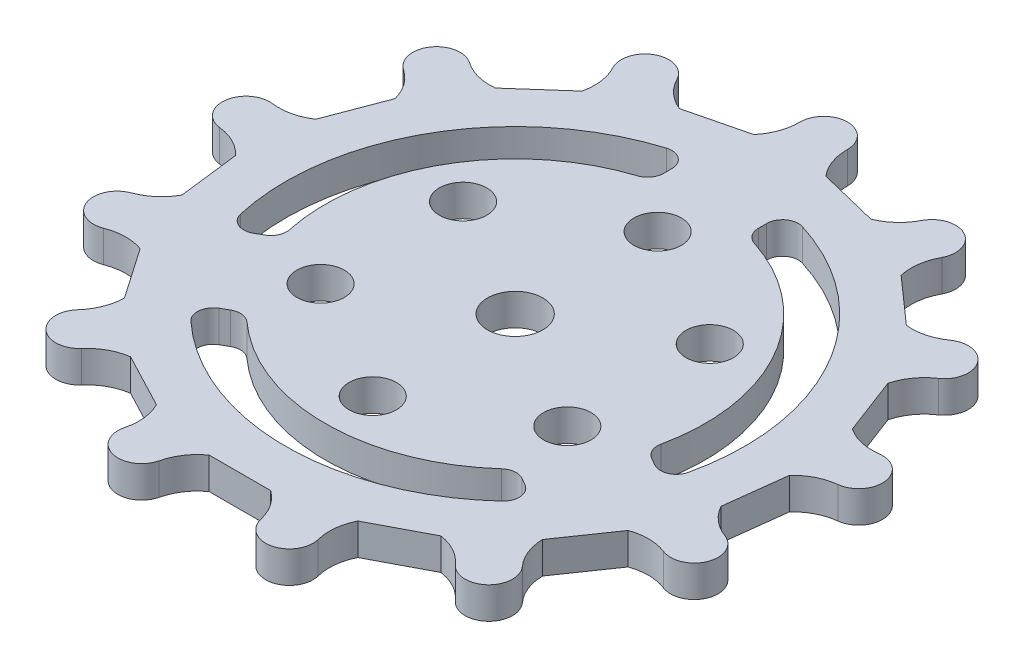
from build123d import *

# Parameters (mm, degrees)
SKETCH1_R           = 1.5
SKETCH1_R_2         = 1.75
BOSS_EXTRUDE3_DEPTH = 2
CUT_EXTRUDE1_DEPTH  = 2
FILLET1_R           = 1


with BuildPart() as part:
    # Sketch1 → Boss-Extrude3 (new body)
    with BuildSketch(Plane(origin=(0, 0, 0), x_dir=(1, 0, 0), z_dir=(0, 1, 0))):
        with BuildLine():
            Line((6.048353149, 16.421553647), (2.27592576, 17.351373488))
            ThreePointArc((2.27592576, 17.351373488), (1.69730064, 18.342788524), (1.499767326, 19.473580897))
            ThreePointArc((1.499767326, 19.473580897), (1.49994183, 19.486789936), (1.5, 19.5))
            ThreePointArc((1.5, 19.5), (0, 21), (-1.5, 19.5))
            ThreePointArc((-1.5, 19.5), (-1.49994183, 19.486789936), (-1.499767326, 19.473580897))
            ThreePointArc((-1.499767326, 19.473580897), (-1.69730064, 18.342788524), (-2.27592576, 17.351373488))
            Line((-2.27592576, 17.351373488), (-6.048353149, 16.421553647))
            ThreePointArc((-6.048353149, 16.421553647), (-7.021433788, 17.030507563), (-7.72184627, 17.939976175))
            ThreePointArc((-7.72184627, 17.939976175), (-7.7278303, 17.951753295), (-7.733917816, 17.963477258))
            ThreePointArc((-7.733917816, 17.963477258), (-9.759186613, 18.594576539), (-10.390285893, 16.569307742))
            ThreePointArc((-10.390285893, 16.569307742), (-10.384020417, 16.557678026), (-10.377802301, 16.546022918))
            ThreePointArc((-10.377802301, 16.546022918), (-10.027203946, 15.452957688), (-10.078817505, 14.30620277))
            Line((-10.078817505, 14.30620277), (-12.987027242, 11.729753767))
            ThreePointArc((-12.987027242, 11.729753767), (-14.131642352, 11.81674256), (-15.174477944, 12.296539112))
            ThreePointArc((-15.174477944, 12.296539112), (-15.18524964, 12.304186316), (-15.196088265, 12.31173836))
            ThreePointArc((-15.196088265, 12.31173836), (-17.282661184, 11.929359681), (-16.900282505, 9.842786762))
            ThreePointArc((-16.900282505, 9.842786762), (-16.889330102, 9.835400872), (-16.878407836, 9.827970489))
            ThreePointArc((-16.878407836, 9.827970489), (-16.059995669, 9.023040475), (-15.572773623, 7.983653406))
            Line((-15.572773623, 7.983653406), (-16.950529904, 4.350808657))
            ThreePointArc((-16.950529904, 4.350808657), (-18.004461959, 3.895904243), (-19.150819593, 3.836113127))
            ThreePointArc((-19.150819593, 3.836113127), (-19.163911289, 3.837878533), (-19.177018025, 3.839528576))
            ThreePointArc((-19.177018025, 3.839528576), (-20.846886356, 2.531270285), (-19.538628065, 0.861401954))
            ThreePointArc((-19.538628065, 0.861401954), (-19.5254978, 0.859951908), (-19.512373542, 0.858448461))
            ThreePointArc((-19.512373542, 0.858448461), (-18.413635928, 0.526053428), (-17.499194975, -0.167854741))
            Line((-17.499194975, -0.167854741), (-17.030870442, -4.024854283))
            ThreePointArc((-17.030870442, -4.024854283), (-17.752676308, -4.917438785), (-18.739939265, -5.503120145))
            ThreePointArc((-18.739939265, -5.503120145), (-18.752351812, -5.50764097), (-18.764724063, -5.512270933))
            ThreePointArc((-18.764724063, -5.512270933), (-19.635341096, -7.446702628), (-17.700909402, -8.317319661))
            ThreePointArc((-17.700909402, -8.317319661), (-17.688609259, -8.312501675), (-17.676289619, -8.307733764))
            ThreePointArc((-17.676289619, -8.307733764), (-16.548934104, -8.09144612), (-15.416761648, -8.280909389))
            Line((-15.416761648, -8.280909389), (-13.209643805, -11.478471612))
            ThreePointArc((-13.209643805, -11.478471612), (-13.433966457, -12.604255849), (-14.035964693, -13.581654911))
            ThreePointArc((-14.035964693, -13.581654911), (-14.044854525, -13.591426301), (-14.053657958, -13.601275602))
            ThreePointArc((-14.053657958, -13.601275602), (-13.925575823, -15.718725712), (-11.808125713, -15.590643577))
            ThreePointArc((-11.808125713, -15.590643577), (-11.799473508, -15.5806613), (-11.790780767, -15.570714303))
            ThreePointArc((-11.790780767, -15.570714303), (-10.893070914, -14.855292874), (-9.802534018, -14.496907492))
            Line((-9.802534018, -14.496907492), (-6.362246966, -16.302509425))
            ThreePointArc((-6.362246966, -16.302509425), (-6.037696789, -17.403589796), (-6.116519761, -18.548796214))
            ThreePointArc((-6.116519761, -18.548796214), (-6.119850325, -18.561579661), (-6.12306818, -18.574391943))
            ThreePointArc((-6.12306818, -18.574391943), (-5.02562895, -20.389778166), (-3.210242727, -19.292338936))
            ThreePointArc((-3.210242727, -19.292338936), (-3.207220575, -19.279479189), (-3.204146136, -19.266631842))
            ThreePointArc((-3.204146136, -19.266631842), (-2.741736452, -18.215971056), (-1.942663979, -17.391838795))
            Line((-1.942663979, -17.391838795), (1.942663979, -17.391838795))
            ThreePointArc((1.942663979, -17.391838795), (2.741736452, -18.215971056), (3.204146136, -19.266631842))
            ThreePointArc((3.204146136, -19.266631842), (3.207137832, -19.279498812), (3.210242727, -19.292338936))
            ThreePointArc((3.210242727, -19.292338936), (5.02562895, -20.389778166), (6.12306818, -18.574391943))
            ThreePointArc((6.12306818, -18.574391943), (6.11976794, -18.561600739), (6.116519761, -18.548796214))
            ThreePointArc((6.116519761, -18.548796214), (6.037696789, -17.403589796), (6.362246966, -16.302509425))
            Line((6.362246966, -16.302509425), (9.802534018, -14.496907492))
            ThreePointArc((9.802534018, -14.496907492), (10.893070914, -14.855292874), (11.790780767, -15.570714303))
            ThreePointArc((11.790780767, -15.570714303), (11.799409362, -15.580717128), (11.808125713, -15.590643577))
            ThreePointArc((11.808125713, -15.590643577), (13.925575823, -15.718725712), (14.053657958, -13.601275602))
            ThreePointArc((14.053657958, -13.601275602), (14.044791371, -13.591483251), (14.035964693, -13.581654911))
            ThreePointArc((14.035964693, -13.581654911), (13.433966458, -12.604255849), (13.209643805, -11.478471612))
            Line((13.209643805, -11.478471612), (15.416761648, -8.280909389))
            ThreePointArc((15.416761648, -8.280909389), (16.548934104, -8.09144612), (17.676289619, -8.307733764))
            ThreePointArc((17.676289619, -8.307733764), (17.688578405, -8.312580919), (17.700909402, -8.317319661))
            ThreePointArc((17.700909402, -8.317319661), (19.635341096, -7.446702628), (18.764724063, -5.512270933))
            ThreePointArc((18.764724063, -5.512270933), (18.752322358, -5.507720745), (18.739939265, -5.503120145))
            ThreePointArc((18.739939265, -5.503120145), (17.752676308, -4.917438785), (17.030870442, -4.024854283))
            Line((17.030870442, -4.024854283), (17.499194975, -0.167854741))
            ThreePointArc((17.499194975, -0.167854741), (18.413635928, 0.526053428), (19.512373542, 0.858448461))
            ThreePointArc((19.512373542, 0.858448461), (19.525507306, 0.859867402), (19.538628065, 0.861401954))
            ThreePointArc((19.538628065, 0.861401954), (20.846886356, 2.531270285), (19.177018025, 3.839528576))
            ThreePointArc((19.177018025, 3.839528576), (19.163922282, 3.837794208), (19.150819593, 3.836113127))
            ThreePointArc((19.150819593, 3.836113127), (18.004461959, 3.895904243), (16.950529904, 4.350808657))
            Line((16.950529904, 4.350808657), (15.572773623, 7.983653406))
            ThreePointArc((15.572773623, 7.983653406), (16.059995669, 9.023040475), (16.878407836, 9.827970489))
            ThreePointArc((16.878407836, 9.827970489), (16.889377792, 9.835330464), (16.900282505, 9.842786762))
            ThreePointArc((16.900282505, 9.842786762), (17.282661184, 11.929359681), (15.196088265, 12.31173836))
            ThreePointArc((15.196088265, 12.31173836), (15.185298562, 12.304116759), (15.174477944, 12.296539112))
            ThreePointArc((15.174477944, 12.296539112), (14.131642352, 11.81674256), (12.987027242, 11.729753767))
            Line((12.987027242, 11.729753767), (10.078817505, 14.30620277))
            ThreePointArc((10.078817505, 14.30620277), (10.027203946, 15.452957688), (10.377802301, 16.546022918))
            ThreePointArc((10.377802301, 16.546022918), (10.384095364, 16.557637845), (10.390285893, 16.569307742))
            ThreePointArc((10.390285893, 16.569307742), (9.759186613, 18.594576539), (7.733917816, 17.963477258))
            ThreePointArc((7.733917816, 17.963477258), (7.727905944, 17.95171444), (7.72184627, 17.939976175))
            ThreePointArc((7.72184627, 17.939976175), (7.021433788, 17.030507563), (6.048353149, 16.421553647))
        make_face()
        with Locations(Location((0, -9, 0), (0, 0, 270))):
            Circle(SKETCH1_R, mode=Mode.SUBTRACT)
        with Locations(Location((-7.794228634, -4.5, 0), (0, 0, 270))):
            Circle(SKETCH1_R, mode=Mode.SUBTRACT)
        with Locations(Location((0, 0, 0), (0, 0, 270))):
            Circle(SKETCH1_R_2, mode=Mode.SUBTRACT)
        with Locations(Location((7.794228634, -4.5, 0), (0, 0, 270))):
            Circle(SKETCH1_R, mode=Mode.SUBTRACT)
        with Locations(Location((-7.794228634, 4.5, 0), (0, 0, 270))):
            Circle(SKETCH1_R, mode=Mode.SUBTRACT)
        with Locations(Location((0, 9, 0), (0, 0, 270))):
            Circle(SKETCH1_R, mode=Mode.SUBTRACT)
        with Locations(Location((7.794228634, 4.5, 0), (0, 0, 270))):
            Circle(SKETCH1_R, mode=Mode.SUBTRACT)
    extrude(amount=BOSS_EXTRUDE3_DEPTH)

    # Sketch3 → Cut-Extrude1 (cut)
    with BuildSketch(Plane(origin=(0, 2, 0), x_dir=(1, 0, 0), z_dir=(0, 1, 0))):
        with BuildLine():
            Line((-3, 14.186260959), (-3, 11.618950039))
            ThreePointArc((-3, 11.618950039), (-10.392304845, 6), (-11.562305899, -3.211398808))
            Line((-11.562305899, -3.211398808), (-13.785662375, -4.495054268))
            ThreePointArc((-13.785662375, -4.495054268), (-12.557368355, 7.25), (-3, 14.186260959))
        make_face()
        with BuildLine():
            Line((3, 14.186260959), (3, 11.618950039))
            ThreePointArc((3, 11.618950039), (10.392304845, 6), (11.562305899, -3.211398808))
            Line((11.562305899, -3.211398808), (13.785662375, -4.495054268))
            ThreePointArc((13.785662375, -4.495054268), (12.557368355, 7.25), (3, 14.186260959))
        make_face()
        with BuildLine():
            Line((10.785662375, -9.691206691), (8.562305899, -8.407551231))
            ThreePointArc((8.562305899, -8.407551231), (0, -12), (-8.562305899, -8.407551231))
            Line((-8.562305899, -8.407551231), (-10.785662375, -9.691206691))
            ThreePointArc((-10.785662375, -9.691206691), (0, -14.5), (10.785662375, -9.691206691))
        make_face()
    extrude(amount=-CUT_EXTRUDE1_DEPTH, mode=Mode.SUBTRACT)

    # Fillet1
    fillet1_edges = [part.edges().sort_by_distance(p)[0] for p in [
        (-8.562305899, 1, 8.407551231),
        (8.562305899, 1, 8.407551231),
        (10.785662375, 1, 9.691206691),
        (-10.785662375, 1, 9.691206691),
        (11.562305899, 1, 3.211398808),
        (3, 1, -11.618950039),
        (3, 1, -14.186260959),
        (13.785662375, 1, 4.495054268),
        (-3, 1, -11.618950039),
        (-11.562305899, 1, 3.211398808),
        (-13.785662375, 1, 4.495054268),
        (-3, 1, -14.186260959),
    ]]
    fillet(fillet1_edges, radius=FILLET1_R)


solid = part.part
